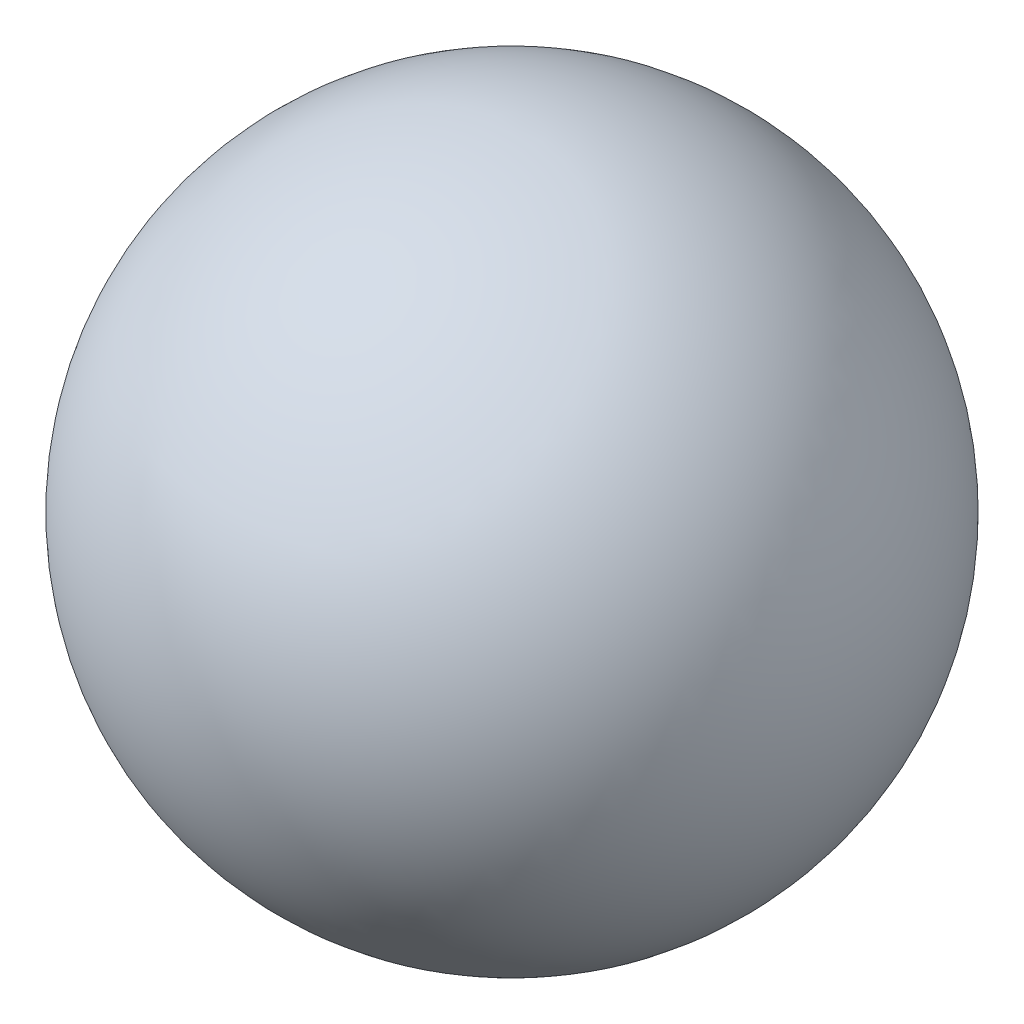
from build123d import *


with BuildPart() as part:
    # Esboço1 → Revolução1 (revolve)
    with BuildSketch(Plane.XY):
        with BuildLine():
            Line((0, 0), (0, 42.76))
            ThreePointArc((0, 42.76), (21.38, 21.38), (0, 0))
        make_face()
    revolve(axis=Axis((0, 0, 0), (0, 1, 0)))


solid = part.part
